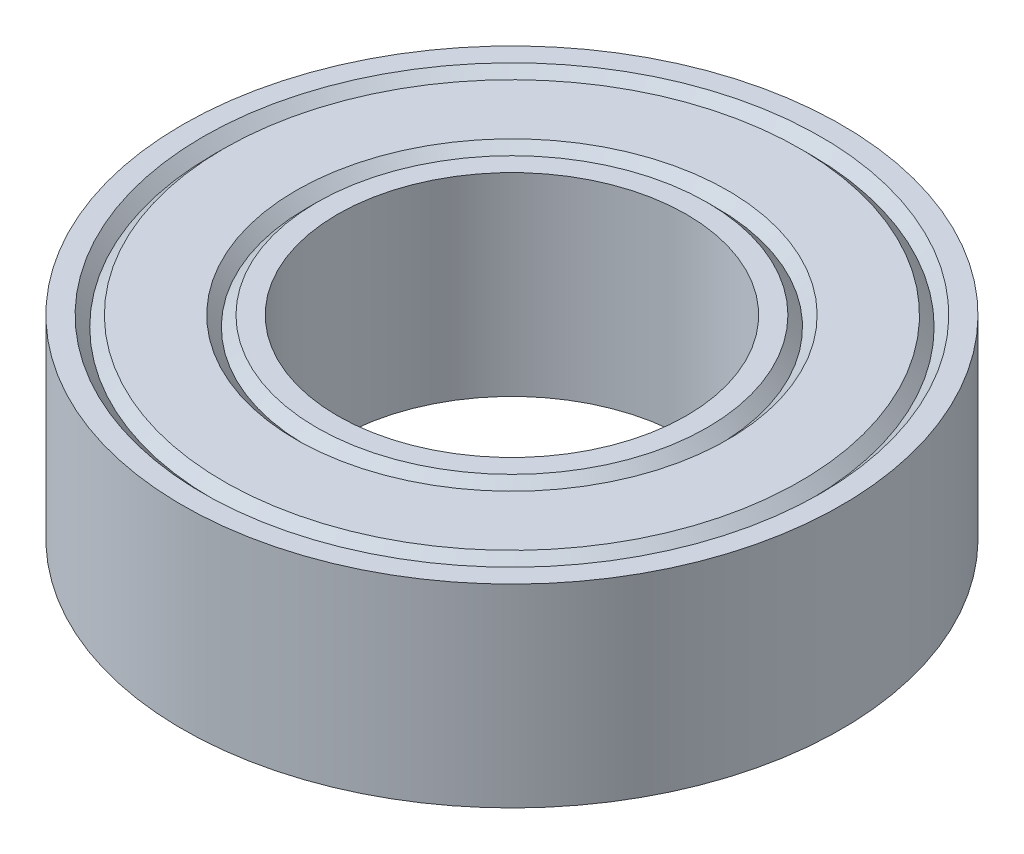
from build123d import *


with BuildPart() as part:
    # Sketch1 → Revolve1 (revolve)
    with BuildSketch(Plane.XY):
        Polygon((-4.5, 2.5), (-5.033333333, 2.5), (-5.3, 2.233333333), (-5.566666667, 2.5), (-7.433333333, 2.5), (-7.7, 2.233333333), (-7.966666667, 2.5), (-8.5, 2.5), (-8.5, -2.5), (-7.966666667, -2.5), (-7.7, -2.233333333), (-7.433333333, -2.5), (-5.566666667, -2.5), (-5.3, -2.233333333), (-5.033333333, -2.5), (-4.5, -2.5), align=None)
    revolve(axis=Axis((0, 2.5, 0), (0, -1, 0)))


solid = part.part
